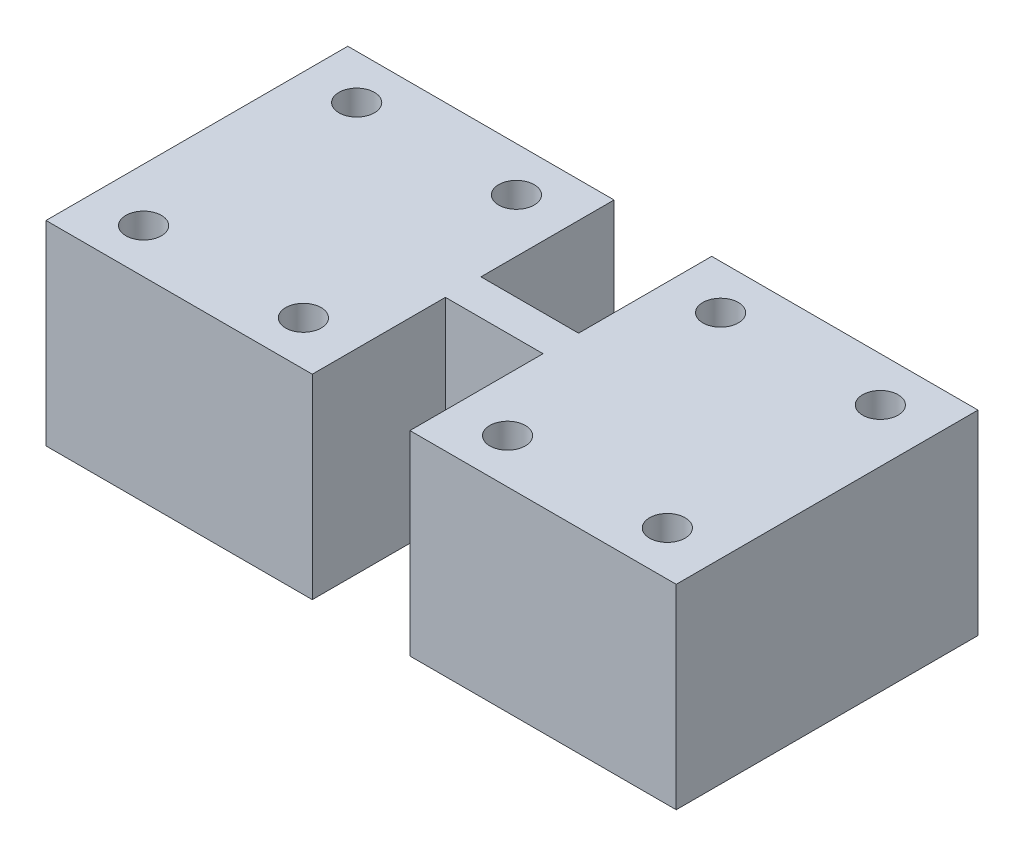
from build123d import *

# Parameters (mm, degrees)
SKETCH_1_R      = 2
EXTRUDE_1_DEPTH = 22


with BuildPart() as part:
    # 草图1 → 凸台-拉伸1 (new body)
    with BuildSketch(Plane(origin=(0, 0, 0), x_dir=(1, 0, 0), z_dir=(0, 1, 0))):
        Polygon((0, 0), (0, 34), (30, 34), (30, 19), (41, 19), (41, 34), (71, 34), (71, 0), (41, 0), (41, 15), (30, 15), (30, 0), align=None)
        with Locations(Location((6, 29, 0), (0, 0, 270))):
            Circle(SKETCH_1_R, mode=Mode.SUBTRACT)
        with Locations(Location((24, 29, 0), (0, 0, 90))):
            Circle(SKETCH_1_R, mode=Mode.SUBTRACT)
        with Locations(Location((24, 5, 0), (0, 0, 270))):
            Circle(SKETCH_1_R, mode=Mode.SUBTRACT)
        with Locations(Location((6, 5, 0), (0, 0, 90))):
            Circle(SKETCH_1_R, mode=Mode.SUBTRACT)
        with Locations(Location((47, 29, 0), (0, 0, 270))):
            Circle(SKETCH_1_R, mode=Mode.SUBTRACT)
        with Locations(Location((47, 5, 0), (0, 0, 90))):
            Circle(SKETCH_1_R, mode=Mode.SUBTRACT)
        with Locations(Location((65, 5, 0), (0, 0, 270))):
            Circle(SKETCH_1_R, mode=Mode.SUBTRACT)
        with Locations(Location((65, 29, 0), (0, 0, 90))):
            Circle(SKETCH_1_R, mode=Mode.SUBTRACT)
    extrude(amount=EXTRUDE_1_DEPTH)


solid = part.part
